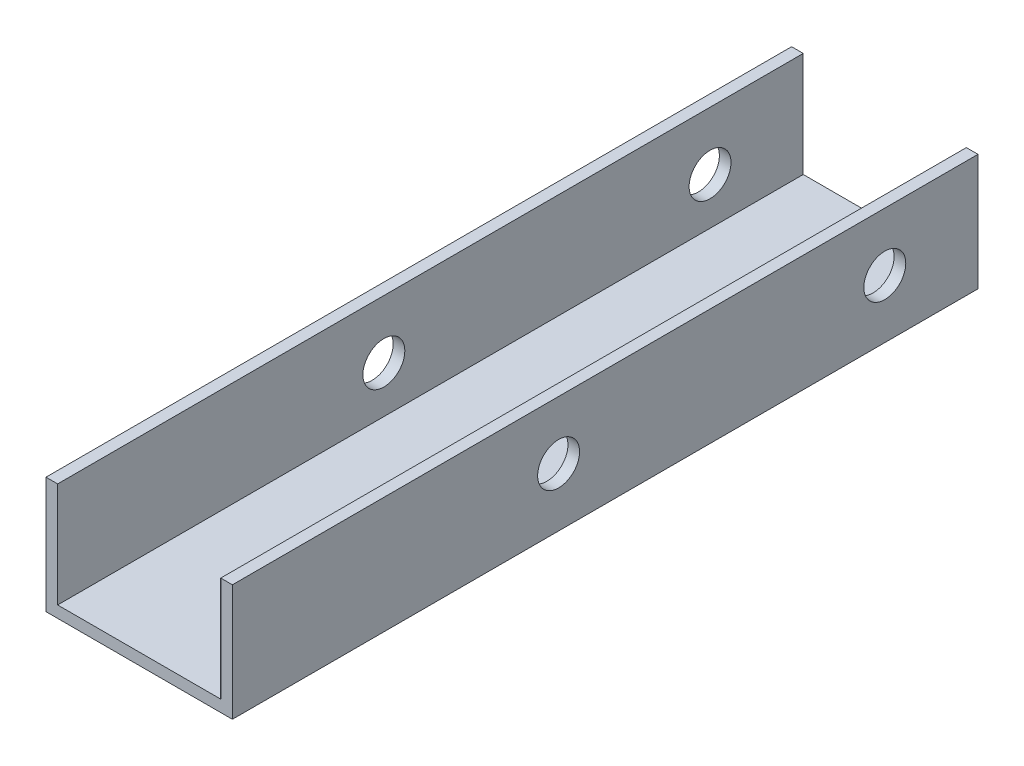
from build123d import *

# Parameters (mm, degrees)
Y_KSEKLIK_EKSTR_ZYON1_DEPTH = 500
IZIM2_R                     = 9
KES_EKSTR_ZYON1_DEPTH       = 100
KES_EKSTR_ZYON3_DEPTH       = 150
KES_EKSTR_ZYON4_DEPTH       = 30


with BuildPart() as part:
    # Çizim1 → Yükseklik-Ekstrüzyon1 (new body)
    with BuildSketch(Plane.XY):
        Polygon((0, 0), (80, 0), (80, 50), (75, 50), (75, 5), (5, 5), (5, 50), (0, 50), align=None)
    extrude(amount=Y_KSEKLIK_EKSTR_ZYON1_DEPTH)

    # Çizim2 → Kes-Ekstrüzyon1 (cut)
    with BuildSketch(Plane(origin=(80, 0, 0), x_dir=(0, 0, -1), z_dir=(1, 0, 0))):
        with Locations((-330, 25)):
            Circle(IZIM2_R)
        with Locations((-190, 25)):
            Circle(IZIM2_R)
    extrude(amount=-KES_EKSTR_ZYON1_DEPTH, mode=Mode.SUBTRACT)

    # Çizim4 → Kes-Ekstrüzyon3 (cut)
    with BuildSketch(Plane(origin=(0, 0, 0), x_dir=(-1, 0, 0), z_dir=(0, 0, -1))):
        Polygon((0, 0), (0, 50), (-5, 50), (-5, 5), (-75, 5), (-75, 50), (-80, 50), (-80, 0), align=None)
    extrude(amount=-KES_EKSTR_ZYON3_DEPTH, mode=Mode.SUBTRACT)

    # Çizim5 → Kes-Ekstrüzyon4 (cut)
    with BuildSketch(Plane.XY.offset(500)):
        Polygon((0, 50), (0, 0), (80, 0), (80, 50), (75, 50), (75, 5), (5, 5), (5, 50), align=None)
    extrude(amount=-KES_EKSTR_ZYON4_DEPTH, mode=Mode.SUBTRACT)


solid = part.part
